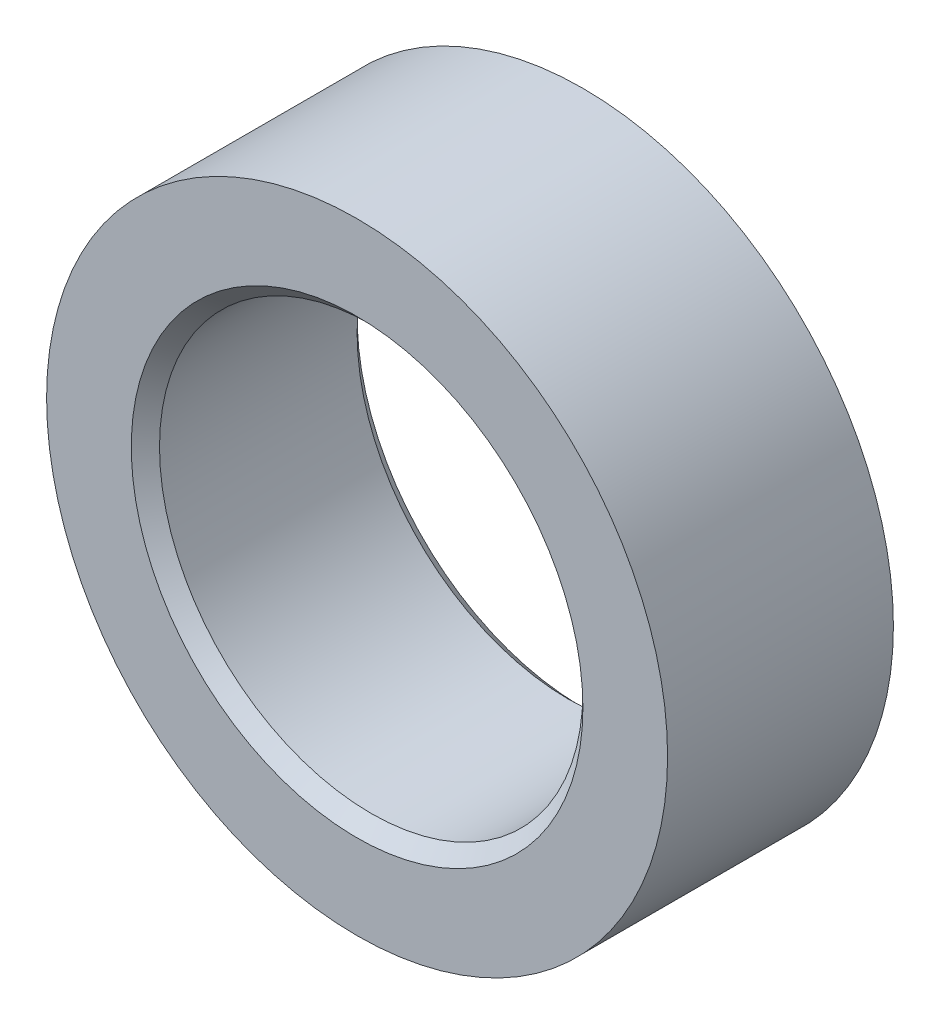
from build123d import *

# Parameters (mm, degrees)
SKETCH1_R           = 11
SKETCH1_R_2         = 7.5
BOSS_EXTRUDE1_DEPTH = 4
CHAMFER1_SIZE       = 0.5


with BuildPart() as part:
    # Sketch1 → Boss-Extrude1 (new, symmetric)
    with BuildSketch(Plane(origin=(0, 0, 0), x_dir=(0, 1, 0), z_dir=(0, 0, 1))):
        with Locations(Location((0, 0, 0), (0, 0, 270))):
            Circle(SKETCH1_R)
        with Locations(Location((0, 0, 0), (0, 0, 270))):
            Circle(SKETCH1_R_2, mode=Mode.SUBTRACT)
    extrude(amount=BOSS_EXTRUDE1_DEPTH, both=True)

    # Chamfer1
    chamfer1_edges = [part.edges().sort_by_distance(p)[0] for p in [
        (-7.5, 0, -4),
        (-7.5, 0, 4),
    ]]
    chamfer(chamfer1_edges, length=CHAMFER1_SIZE)


solid = part.part
